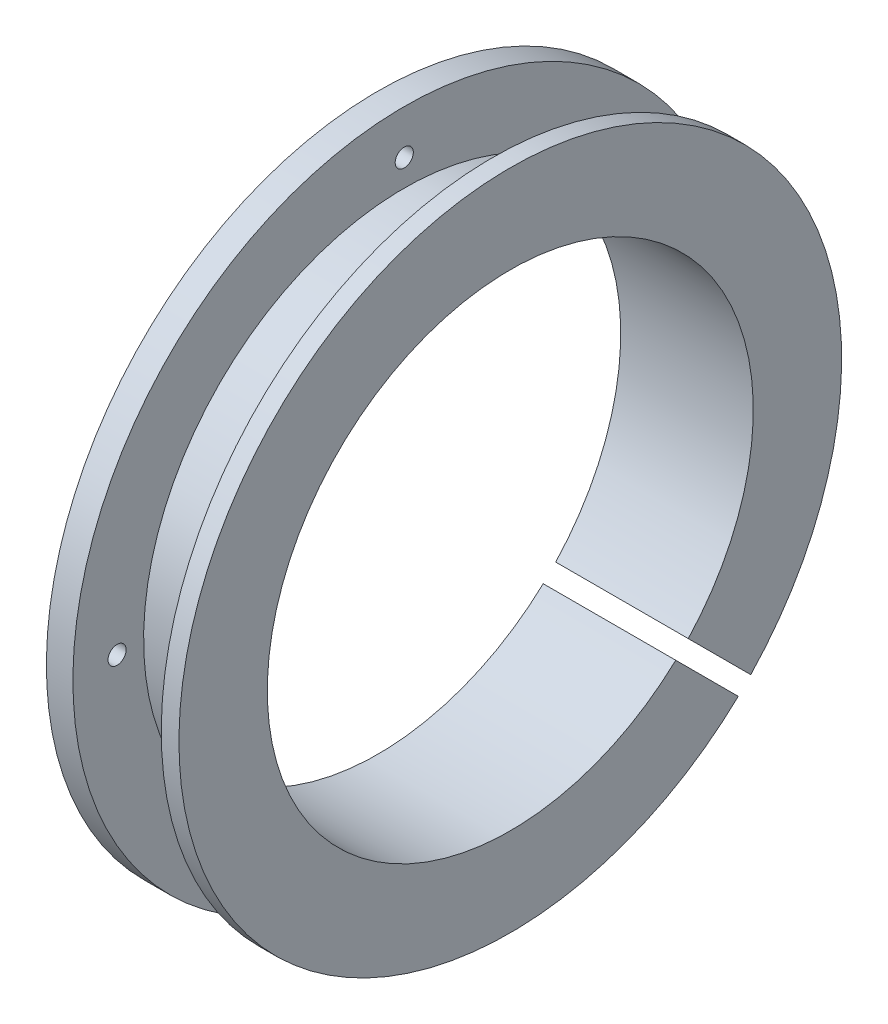
from build123d import *

# Parameters (mm, degrees)
M2_5X0_45_TAPPED_HOLE2_D     = 2.05
M2_5X0_45_TAPPED_HOLE2_DEPTH = 6.35
M2_5X0_45_TAPPED_HOLE2_TIP   = 0.615882135
CUT_EXTRUDE1_DEPTH           = 56.113519213


with BuildPart() as part:
    # Sketch1 → Revolve1 (revolve)
    with BuildSketch(Plane.XY, mode=Mode.PRIVATE) as revolve1_sk:
        Polygon((-15, 27.5), (0, 27.5), (0, 37.5), (-2, 37.5), (-2, 29.5), (-12, 29.5), (-12, 37.5), (-15, 37.5), align=None)
    revolve(revolve1_sk.sketch.rotate(Axis((0, 0, 0), (-1, 0, 0)), 90), axis=Axis((0, 0, 0), (-1, 0, 0)))

    # M2.5x0.45 Tapped Hole2
    with Locations(Plane.ZY.offset(15)):
        with Locations((0, -32.5), (-32.5, 0), (32.5, 0), (0, 32.5)):
            Hole(M2_5X0_45_TAPPED_HOLE2_D / 2, depth=M2_5X0_45_TAPPED_HOLE2_DEPTH)
            with Locations((0, 0, -(M2_5X0_45_TAPPED_HOLE2_DEPTH + M2_5X0_45_TAPPED_HOLE2_TIP / 2))):  # 118° drill point
                Cone(0, M2_5X0_45_TAPPED_HOLE2_D / 2, M2_5X0_45_TAPPED_HOLE2_TIP, mode=Mode.SUBTRACT)

    # Sketch6 → Cut-Extrude1 (cut, through all)
    with BuildSketch(Plane(origin=(0, 0, 0), x_dir=(0, 0, -1), z_dir=(1, 0, 0))):
        Polygon((27.223611076, -25.809397513), (25.809397513, -27.223611076), (18.725468962, -20.139682524), (20.139682524, -18.725468962), align=None)
    extrude(amount=-CUT_EXTRUDE1_DEPTH, mode=Mode.SUBTRACT)


solid = part.part
